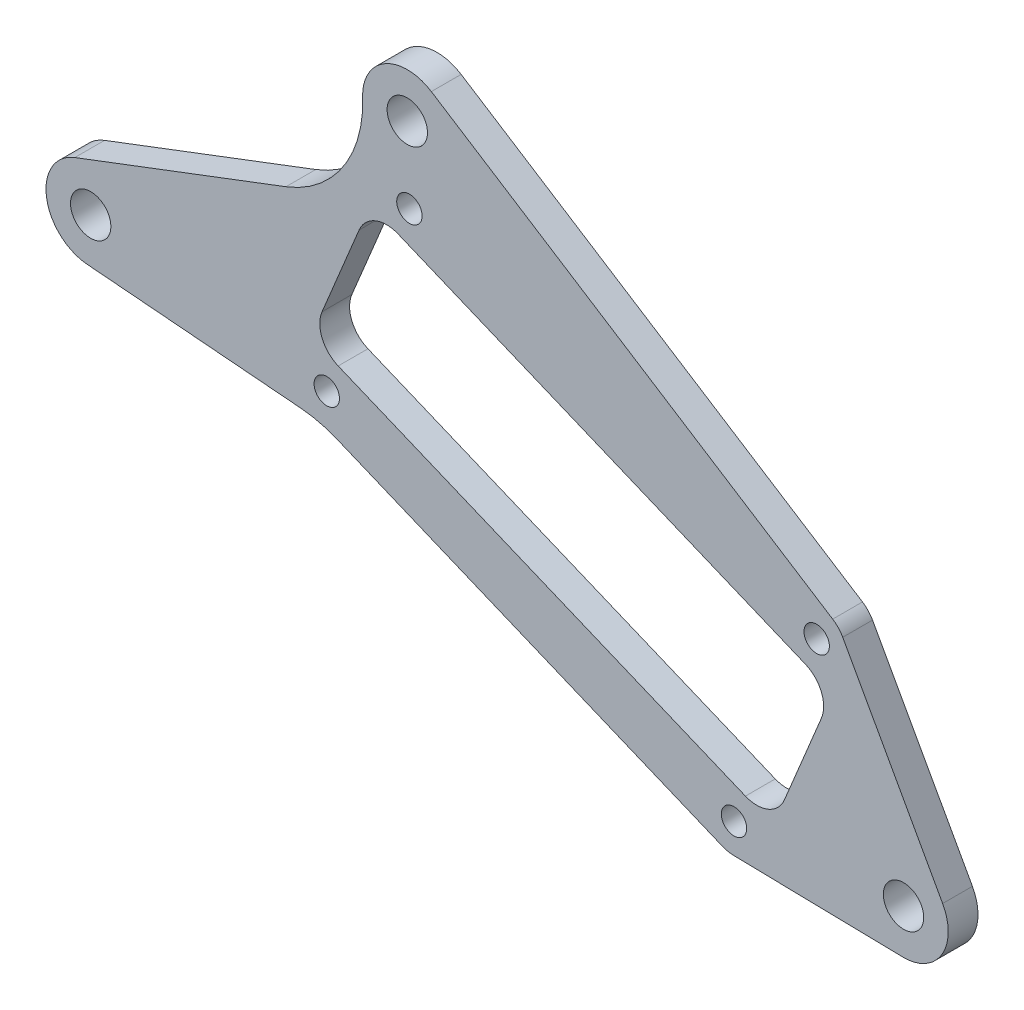
from build123d import *

# Parameters (mm, degrees)
BOSS_EXTRUDE1_DEPTH   = 3.175
FILLET1_R             = 3.175
F_6_CLEARANCE_HOLE1_D = 4.3053
F_2_CLEARANCE_HOLE1_D = 2.7051
FILLET2_R             = 12.7


with BuildPart() as part:
    # Sketch1 → Boss-Extrude1 (new body)
    with BuildSketch(Plane.XY):
        with BuildLine():
            Line((-0.394361249, -4.746144273), (24.410778081, -6.807224837))
            Line((24.410778081, -6.807224837), (67.367437597, -24.620374852))
            ThreePointArc((67.367437597, -24.620374852), (67.932057441, -24.79496394), (68.519252784, -24.861885891))
            Line((68.519252784, -24.861885891), (86.557178011, -25.22763618))
            ThreePointArc((86.557178011, -25.22763618), (90.731319104, -22.926733092), (90.821358826, -18.161284348))
            Line((90.821358826, -18.161284348), (80.17216718, 1.094759821))
            ThreePointArc((80.17216718, 1.094759821), (79.70833798, 1.731518351), (79.102014267, 2.234480087))
            Line((79.102014267, 2.234480087), (36.315798025, 29.544973103))
            ThreePointArc((36.315798025, 29.544973103), (31.002904726, 29.418519327), (29.114914109, 24.450791758))
            Line((29.114914109, 24.450791758), (30.886207986, 16.841662569))
            Line((30.886207986, 16.841662569), (-1.692935369, 4.451446516))
            ThreePointArc((-1.692935369, 4.451446516), (-4.715731213, -0.6657968), (-0.394361249, -4.746144273))
        make_face()
        Polygon((72.732635266, -19.970882517), (23.451745327, 0.464782063), (29.829511311, 15.844853618), (79.11040125, -4.590810962), align=None, mode=Mode.SUBTRACT)
    extrude(amount=BOSS_EXTRUDE1_DEPTH)

    # Fillet1
    fillet1_edges = [part.edges().sort_by_distance(p)[0] for p in [
        (72.732635266, -19.970882517, 1.5875),
        (79.11040125, -4.590810962, 1.5875),
        (29.829511311, 15.844853618, 1.5875),
        (23.451745327, 0.464782063, 1.5875),
    ]]
    fillet(fillet1_edges, radius=FILLET1_R)

    # #6 Clearance Hole1 (through all)
    with Locations(Plane.XY.offset(3.175)):
        with Locations((0, 0), (33.7533947, 25.530562131), (86.653726131, -20.46611492)):
            Hole(F_6_CLEARANCE_HOLE1_D / 2)

    # #2 Clearance Hole1 (through all)
    with Locations(Plane.XY.offset(3.175)):
        with Locations((33.97852838, 17.561509485), (77.393745383, -0.441793894), (68.583618198, -21.687538385), (25.168401194, -3.684235006)):
            Hole(F_2_CLEARANCE_HOLE1_D / 2)

    # Fillet2
    fillet2_edges = [part.edges().sort_by_distance(p)[0] for p in [
        (24.410778081, -6.807224837, 1.5875),
        (30.886207986, 16.841662569, 1.5875),
    ]]
    fillet(fillet2_edges, radius=FILLET2_R)


solid = part.part
